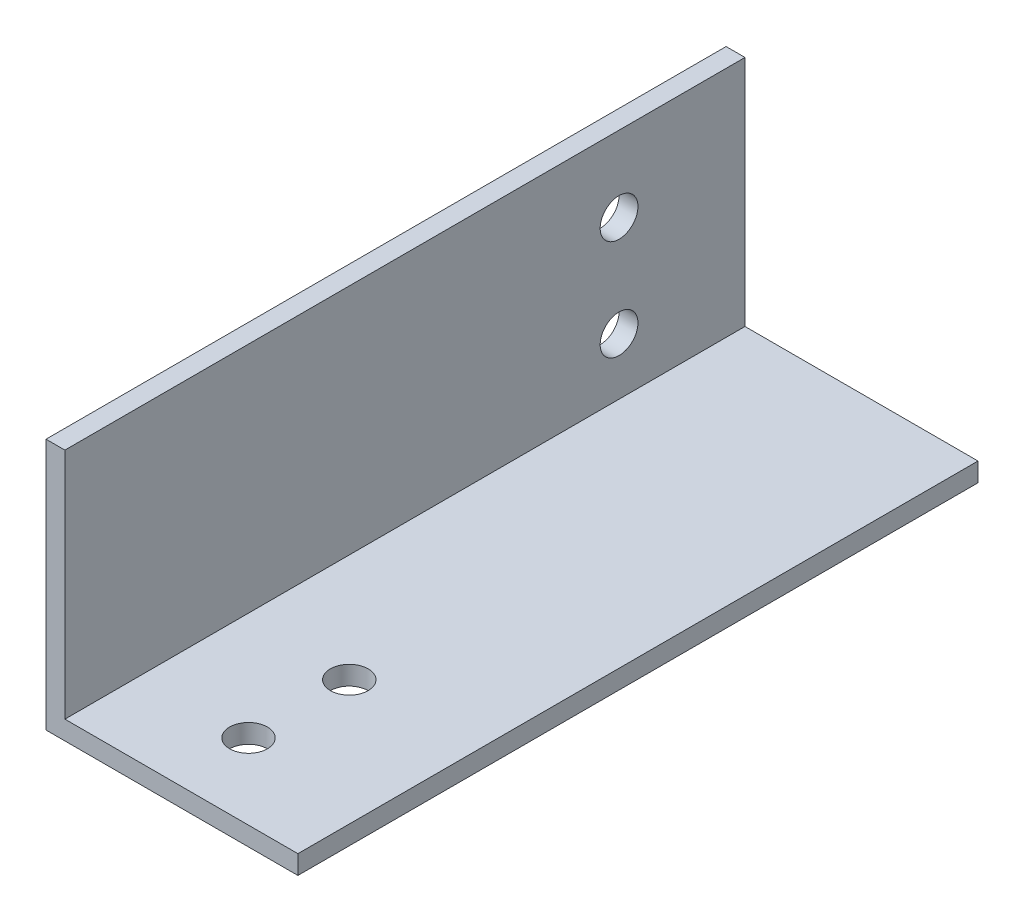
from build123d import *

# Parameters (mm, degrees)
EXTRUSION1_DEPTH = 54
ESQUISSE2_R      = 1.5
EXTRUSION2_DEPTH = 20
ESQUISSE3_R      = 1.5
EXTRUSION3_DEPTH = 10


with BuildPart() as part:
    # Esquisse1 → Extrusion1 (new body)
    with BuildSketch(Plane.XY):
        Polygon((-18.714271359, 3.498089172), (-18.714271359, -16.501910828), (1.285728641, -16.501910828), (1.285728641, -15.001910828), (-17.214271359, -15.001910828), (-17.214271359, 3.498089172), align=None)
    extrude(amount=EXTRUSION1_DEPTH)

    # Esquisse2 → Extrusion2 (cut)
    with BuildSketch(Plane(origin=(0, -15.001910828, 0), x_dir=(-1, 0, 0), z_dir=(0, 1, 0))):
        with Locations((8.633652734, 48)):
            Circle(ESQUISSE2_R)
        with Locations((8.633652734, 40)):
            Circle(ESQUISSE2_R)
    extrude(amount=-EXTRUSION2_DEPTH, mode=Mode.SUBTRACT)

    # Esquisse3 → Extrusion3 (cut)
    with BuildSketch(Plane.ZY.offset(18.714271359)):
        with Locations(Location((10, -2.501910828, 0), (0, 0, 270))):
            Circle(ESQUISSE3_R)
        with Locations(Location((10, -10.501910828, 0), (0, 0, 270))):
            Circle(ESQUISSE3_R)
    extrude(amount=-EXTRUSION3_DEPTH, mode=Mode.SUBTRACT)


solid = part.part
